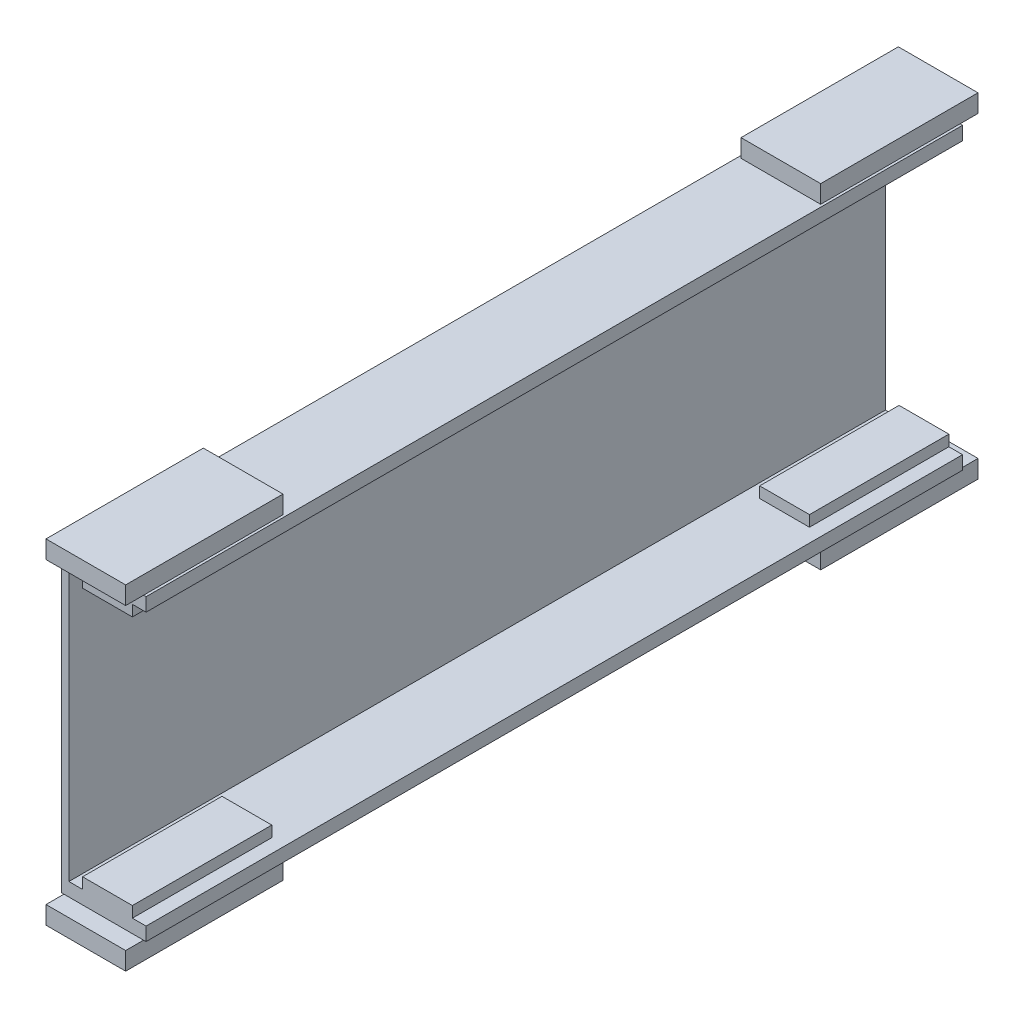
from build123d import *

# Parameters (mm, degrees)
SKETCH_1_W               = 85
SKETCH_1_H               = 300
EXTRUDE_1_DEPTH          = 820
SKETCH_2_W               = 77.5
SKETCH_2_H               = 273
CUT_EXTRUDE_1_DEPTH      = 878.282736636
SKETCH_5_W               = 50
SKETCH_5_H               = 140
EXTRUDE_3_DEPTH          = 11
SKETCH_6_W               = 80
SKETCH_6_H               = 158
EXTRUDE_4_DEPTH          = 18
MIRROR_4_COPY_1_SKETCH_W = 50
MIRROR_4_COPY_1_SKETCH_H = 140
MIRROR_4_COPY_1_DEPTH    = 11
MIRROR_4_COPY_2_SKETCH_W = 80
MIRROR_4_COPY_2_SKETCH_H = 158
MIRROR_4_COPY_2_DEPTH    = 18


with BuildPart() as part:
    # 草图1 → 凸台-拉伸1 (new body)
    with BuildSketch(Plane.XY):
        with Locations((42.5, 150)):
            Rectangle(SKETCH_1_W, SKETCH_1_H)
    extrude(amount=EXTRUDE_1_DEPTH)

    # 草图2 → 切除-拉伸1 (cut, through all)
    with BuildSketch(Plane.XY.offset(820)):
        with Locations((46.25, 150)):
            Rectangle(SKETCH_2_W, SKETCH_2_H)
    extrude(amount=-CUT_EXTRUDE_1_DEPTH, mode=Mode.SUBTRACT)

    # 草图5 → 凸台-拉伸3 (add)
    with BuildSketch(Plane.XZ.offset(-286.5)):
        with Locations((46.25, 70)):
            Rectangle(SKETCH_5_W, SKETCH_5_H)
    extrude_3 = extrude(amount=EXTRUDE_3_DEPTH)

    # 草图6 → 凸台-拉伸4 (add)
    with BuildSketch(Plane(origin=(0, 300, 0), x_dir=(1, 0, 0), z_dir=(0, 1, 0))):
        with Locations((42.5, -61)):
            Rectangle(SKETCH_6_W, SKETCH_6_H)
    extrude_4 = extrude(amount=EXTRUDE_4_DEPTH)

    # 镜向3: 凸台-拉伸3, 凸台-拉伸4 across plane
    add(extrude_3.mirror(Plane(origin=(0, 150, 0), x_dir=(0, 0, 1), z_dir=(0, -1, 0))))
    add(extrude_4.mirror(Plane(origin=(0, 150, 0), x_dir=(0, 0, 1), z_dir=(0, -1, 0))))

    # 镜向4: 凸台-拉伸3, 凸台-拉伸4 across plane
    add(extrude_3.mirror(Plane(origin=(0, 0, 410), x_dir=(1, 0, 0), z_dir=(0, 0, -1))))
    add(extrude_4.mirror(Plane(origin=(0, 0, 410), x_dir=(1, 0, 0), z_dir=(0, 0, -1))))

    # 镜向4 copy 1 sketch → 镜向4 copy 1 (add)
    with BuildSketch(Plane(origin=(0, 13.5, 820), x_dir=(1, 0, 0), z_dir=(0, 1, 0))):
        with Locations((46.25, 70)):
            Rectangle(MIRROR_4_COPY_1_SKETCH_W, MIRROR_4_COPY_1_SKETCH_H)
    extrude(amount=MIRROR_4_COPY_1_DEPTH)

    # 镜向4 copy 2 sketch → 镜向4 copy 2 (add)
    with BuildSketch(Plane(origin=(0, 0, 820), x_dir=(1, 0, 0), z_dir=(0, -1, 0))):
        with Locations((42.5, -61)):
            Rectangle(MIRROR_4_COPY_2_SKETCH_W, MIRROR_4_COPY_2_SKETCH_H)
    extrude(amount=MIRROR_4_COPY_2_DEPTH)


solid = part.part
